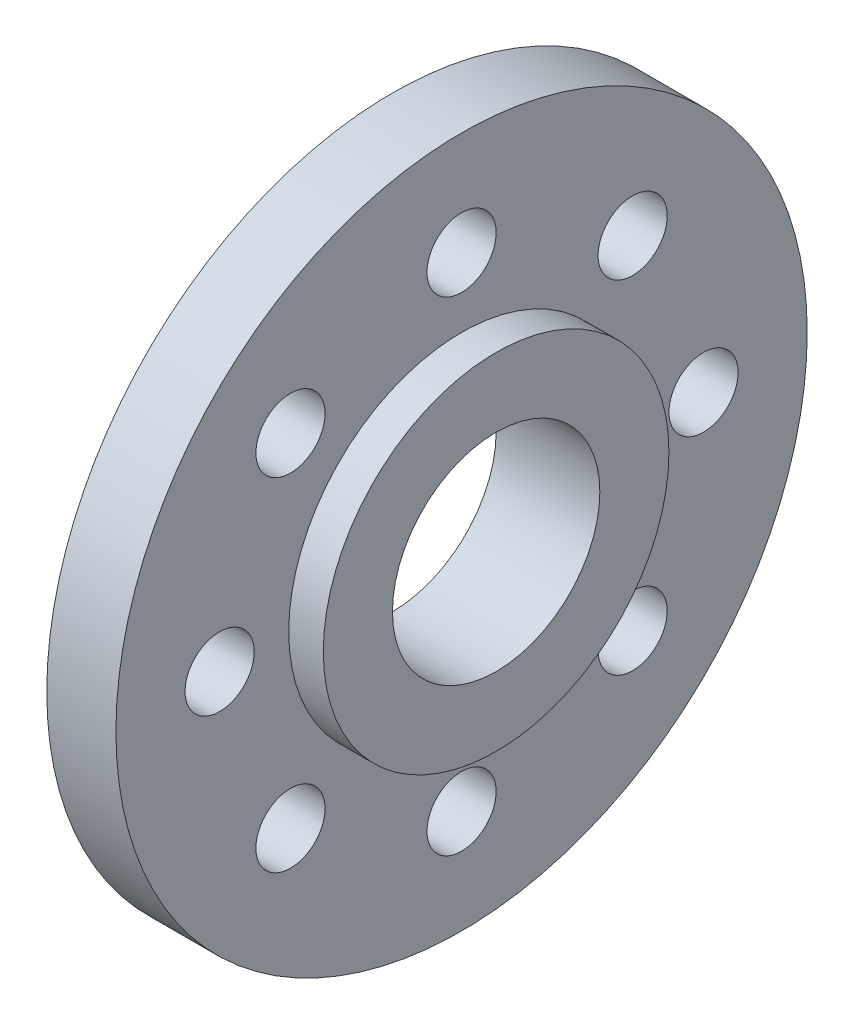
from build123d import *

# Parameters (mm, degrees)
SKETCH_1_R               = 10
EXTRUDE_1_DEPTH          = 2
SKETCH_3_R               = 3
CUT_EXTRUDE_1_DEPTH      = 15.282856857
EXTRUDE_START            = 1
SKETCH_4_R               = 5
SKETCH_4_R_2             = 3
EXTRUDE_2_DEPTH          = 1
SKETCH_5_R               = 1
CUT_EXTRUDE_2_DEPTH      = 15.456832295
PATTERN_CIRCULAR_1_COUNT = 8


with BuildPart() as part:
    # 草图1 → 凸台-拉伸1 (new body)
    with BuildSketch(Plane(origin=(0, 0, 0), x_dir=(0, 0, -1), z_dir=(1, 0, 0))):
        Circle(SKETCH_1_R)
    extrude(amount=EXTRUDE_1_DEPTH)

    # 草图3 → 切除-拉伸1 (cut, through all)
    with BuildSketch(Plane(origin=(2, 0, 0), x_dir=(0, 0, -1), z_dir=(1, 0, 0))):
        Circle(SKETCH_3_R)
    extrude(amount=-CUT_EXTRUDE_1_DEPTH, mode=Mode.SUBTRACT)

    # 草图4 → 凸台-拉伸2 (add)
    with BuildSketch(Plane(origin=(2, 0, 0), x_dir=(0, 0, -1), z_dir=(1, 0, 0)).offset(EXTRUDE_START)):
        Circle(SKETCH_4_R)
        Circle(SKETCH_4_R_2, mode=Mode.SUBTRACT)
    extrude(amount=-EXTRUDE_2_DEPTH)

    # 草图5 → 切除-拉伸2 (cut, through all)
    with BuildSketch(Plane.ZY):
        with Locations((0, 7)):
            Circle(SKETCH_5_R)
    cut_extrude_2 = extrude(amount=-CUT_EXTRUDE_2_DEPTH, mode=Mode.SUBTRACT)

    # 阵列(圆周)1: 切除-拉伸2 ×8 about axis
    pattern_circular_1_axis = Axis((0, 0, 0), (1, 0, 0))
    for i in range(1, PATTERN_CIRCULAR_1_COUNT):
        add(cut_extrude_2.rotate(pattern_circular_1_axis, i * 360 / PATTERN_CIRCULAR_1_COUNT), mode=Mode.SUBTRACT)


solid = part.part
